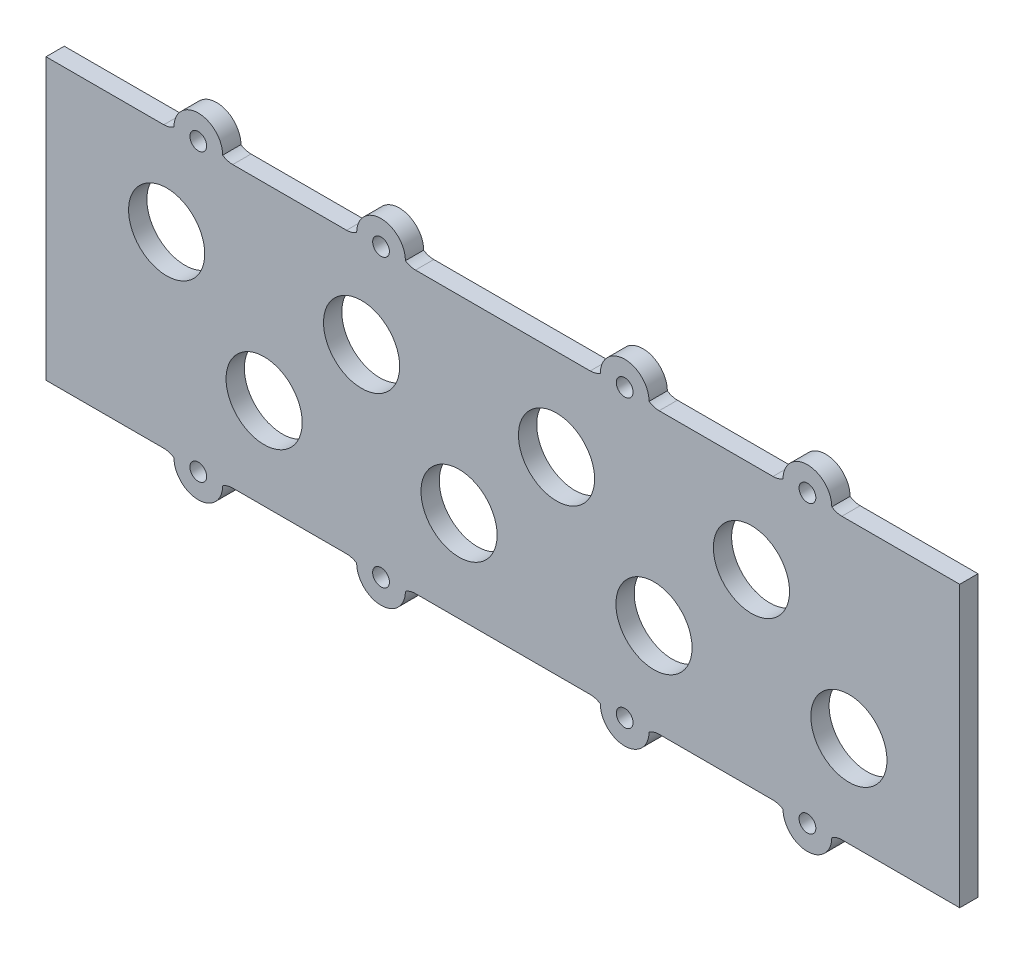
from build123d import *

# Parameters (mm, degrees)
SKETCH1_R           = 1.375
SKETCH1_R_2         = 6.25
BOSS_EXTRUDE1_DEPTH = 3


with BuildPart() as part:
    # Sketch1 → Boss-Extrude1 (new body)
    with BuildSketch(Plane.XY):
        with BuildLine():
            Line((-75, 23), (-75, -23))
            Line((-75, -23), (-55.658312395, -23))
            ThreePointArc((-55.658312395, -23), (-54.792286991, -23.127718677), (-54, -23.5))
            ThreePointArc((-54, -23.5), (-50, -27.5), (-46, -23.5))
            ThreePointArc((-46, -23.5), (-45.207713009, -23.127718677), (-44.341687605, -23))
            Line((-44.341687605, -23), (-25.658312395, -23))
            ThreePointArc((-25.658312395, -23), (-24.792286991, -23.127718677), (-24, -23.5))
            ThreePointArc((-24, -23.5), (-20, -27.5), (-16, -23.5))
            ThreePointArc((-16, -23.5), (-15.207713009, -23.127718677), (-14.341687605, -23))
            Line((-14.341687605, -23), (14.341687605, -23))
            ThreePointArc((14.341687605, -23), (15.207713009, -23.127718677), (16, -23.5))
            ThreePointArc((16, -23.5), (20, -27.5), (24, -23.5))
            ThreePointArc((24, -23.5), (24.792286991, -23.127718677), (25.658312395, -23))
            Line((25.658312395, -23), (44.341687605, -23))
            ThreePointArc((44.341687605, -23), (45.207713009, -23.127718677), (46, -23.5))
            ThreePointArc((46, -23.5), (50, -27.5), (54, -23.5))
            ThreePointArc((54, -23.5), (54.792286991, -23.127718677), (55.658312395, -23))
            Line((55.658312395, -23), (75, -23))
            Line((75, -23), (75, 23))
            Line((75, 23), (55.658312395, 23))
            ThreePointArc((55.658312395, 23), (54.792286991, 23.127718677), (54, 23.5))
            ThreePointArc((54, 23.5), (50, 27.5), (46, 23.5))
            ThreePointArc((46, 23.5), (45.207713009, 23.127718677), (44.341687605, 23))
            Line((44.341687605, 23), (25.658312395, 23))
            ThreePointArc((25.658312395, 23), (24.792286991, 23.127718677), (24, 23.5))
            ThreePointArc((24, 23.5), (20, 27.5), (16, 23.5))
            ThreePointArc((16, 23.5), (15.207713009, 23.127718677), (14.341687605, 23))
            Line((14.341687605, 23), (-14.341687605, 23))
            ThreePointArc((-14.341687605, 23), (-15.207713009, 23.127718677), (-16, 23.5))
            ThreePointArc((-16, 23.5), (-20, 27.5), (-24, 23.5))
            ThreePointArc((-24, 23.5), (-24.792286991, 23.127718677), (-25.658312395, 23))
            Line((-25.658312395, 23), (-44.341687605, 23))
            ThreePointArc((-44.341687605, 23), (-45.207713009, 23.127718677), (-46, 23.5))
            ThreePointArc((-46, 23.5), (-50, 27.5), (-54, 23.5))
            ThreePointArc((-54, 23.5), (-54.792286991, 23.127718677), (-55.658312395, 23))
            Line((-55.658312395, 23), (-75, 23))
        make_face()
        with Locations((-50, -23.5)):
            Circle(SKETCH1_R, mode=Mode.SUBTRACT)
        with Locations((-20, -23.5)):
            Circle(SKETCH1_R, mode=Mode.SUBTRACT)
        with Locations((20, -23.5)):
            Circle(SKETCH1_R, mode=Mode.SUBTRACT)
        with Locations((50, -23.5)):
            Circle(SKETCH1_R, mode=Mode.SUBTRACT)
        with Locations((50, 23.5)):
            Circle(SKETCH1_R, mode=Mode.SUBTRACT)
        with Locations((20, 23.5)):
            Circle(SKETCH1_R, mode=Mode.SUBTRACT)
        with Locations((-20, 23.5)):
            Circle(SKETCH1_R, mode=Mode.SUBTRACT)
        with Locations((-50, 23.5)):
            Circle(SKETCH1_R, mode=Mode.SUBTRACT)
        with Locations((-55.192693601, 8)):
            Circle(SKETCH1_R_2, mode=Mode.SUBTRACT)
        with Locations((-23.192693601, 8)):
            Circle(SKETCH1_R_2, mode=Mode.SUBTRACT)
        with Locations((8.807306399, 8)):
            Circle(SKETCH1_R_2, mode=Mode.SUBTRACT)
        with Locations((40.807306399, 8)):
            Circle(SKETCH1_R_2, mode=Mode.SUBTRACT)
        with Locations((-39.192693601, -8)):
            Circle(SKETCH1_R_2, mode=Mode.SUBTRACT)
        with Locations((-7.192693601, -8)):
            Circle(SKETCH1_R_2, mode=Mode.SUBTRACT)
        with Locations((24.807306399, -8)):
            Circle(SKETCH1_R_2, mode=Mode.SUBTRACT)
        with Locations((56.807306399, -8)):
            Circle(SKETCH1_R_2, mode=Mode.SUBTRACT)
    extrude(amount=BOSS_EXTRUDE1_DEPTH)


solid = part.part
